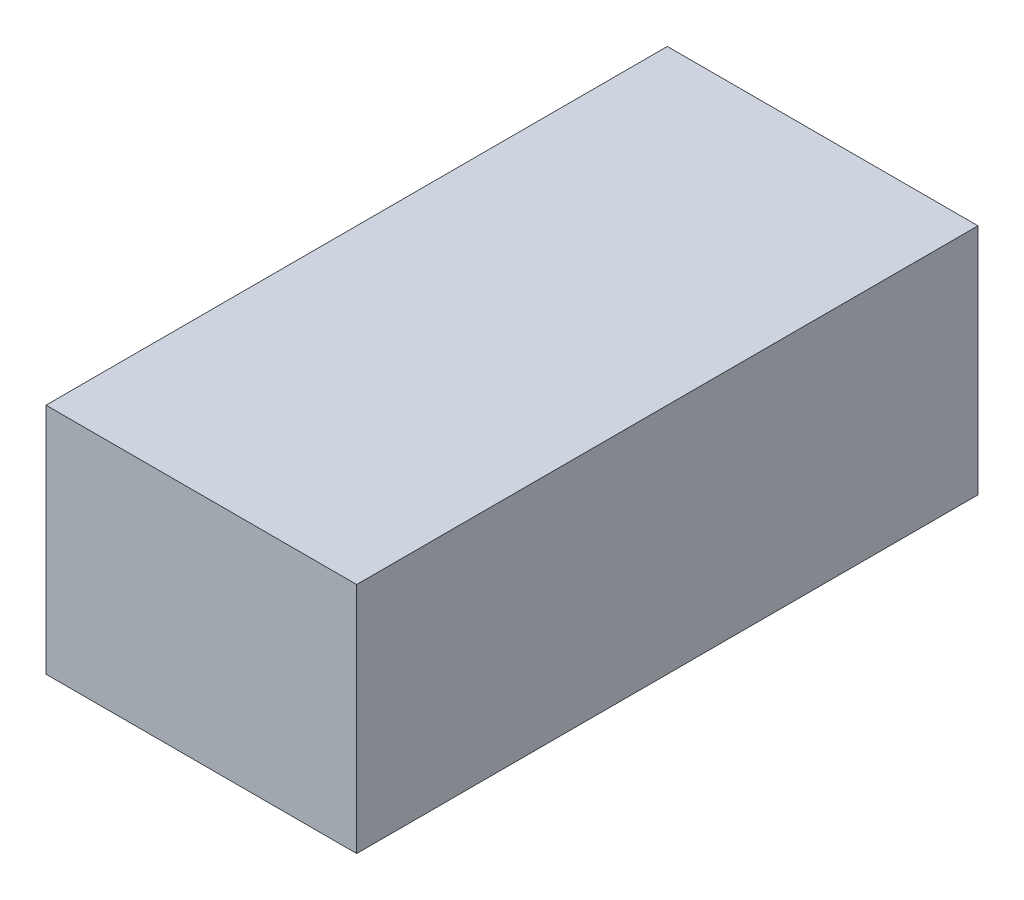
from build123d import *

# Parameters (mm, degrees)
SKETCH1_W           = 100
SKETCH1_H           = 200
BOSS_EXTRUDE1_DEPTH = 75


with BuildPart() as part:
    # Sketch1 → Boss-Extrude1 (new body)
    with BuildSketch(Plane(origin=(0, 0, 0), x_dir=(1, 0, 0), z_dir=(0, 1, 0))):
        Rectangle(SKETCH1_W, SKETCH1_H)
    extrude(amount=BOSS_EXTRUDE1_DEPTH)


solid = part.part
